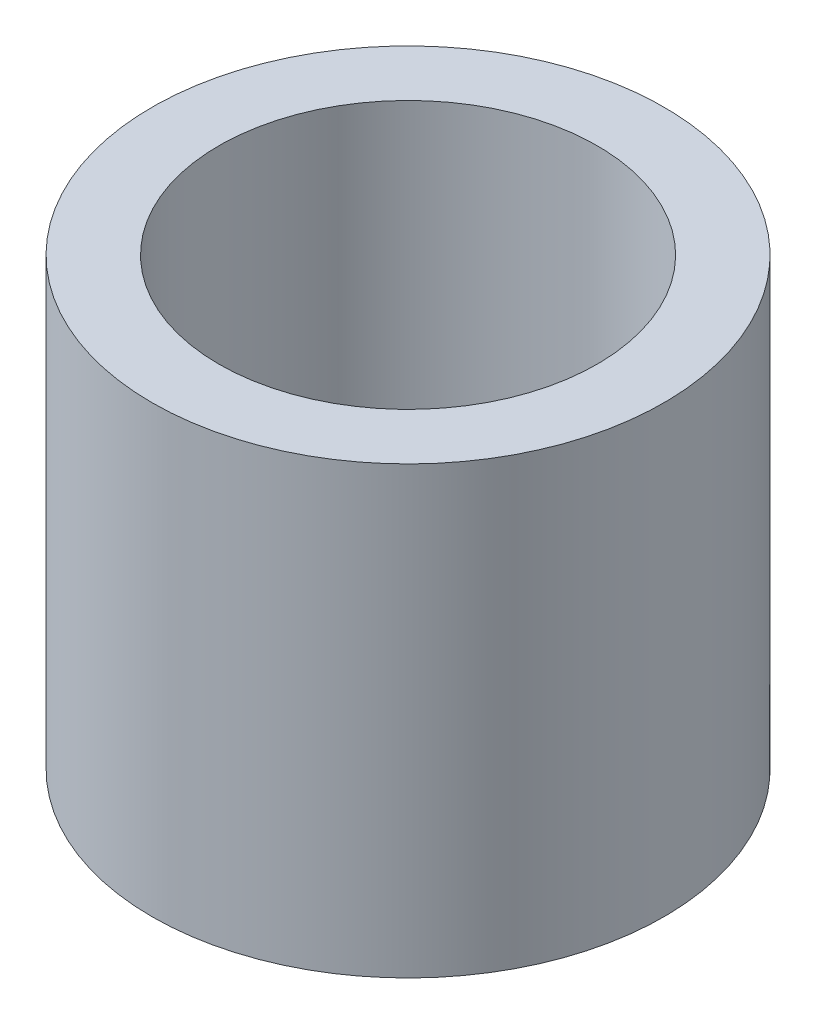
from build123d import *

# Parameters (mm, degrees)
SKETCH_1_R      = 23
EXTRUDE_1_DEPTH = 6
SKETCH_2_R      = 23
SKETCH_2_R_2    = 17
EXTRUDE_2_DEPTH = 34


with BuildPart() as part:
    # Эскиз1 → Бобышка-Вытянуть1 (new body)
    with BuildSketch(Plane(origin=(0, 0, 0), x_dir=(1, 0, 0), z_dir=(0, 1, 0))):
        with Locations(Location((0, 0, 0), (0, 0, 270))):
            Circle(SKETCH_1_R)
    extrude(amount=EXTRUDE_1_DEPTH)

    # Эскиз2 → Бобышка-Вытянуть2 (add)
    with BuildSketch(Plane(origin=(0, 6, 0), x_dir=(1, 0, 0), z_dir=(0, 1, 0))):
        with Locations(Location((0, 0, 0), (0, 0, 270))):
            Circle(SKETCH_2_R)
        with Locations(Location((0, 0, 0), (0, 0, 270))):
            Circle(SKETCH_2_R_2, mode=Mode.SUBTRACT)
    extrude(amount=EXTRUDE_2_DEPTH)


solid = part.part
